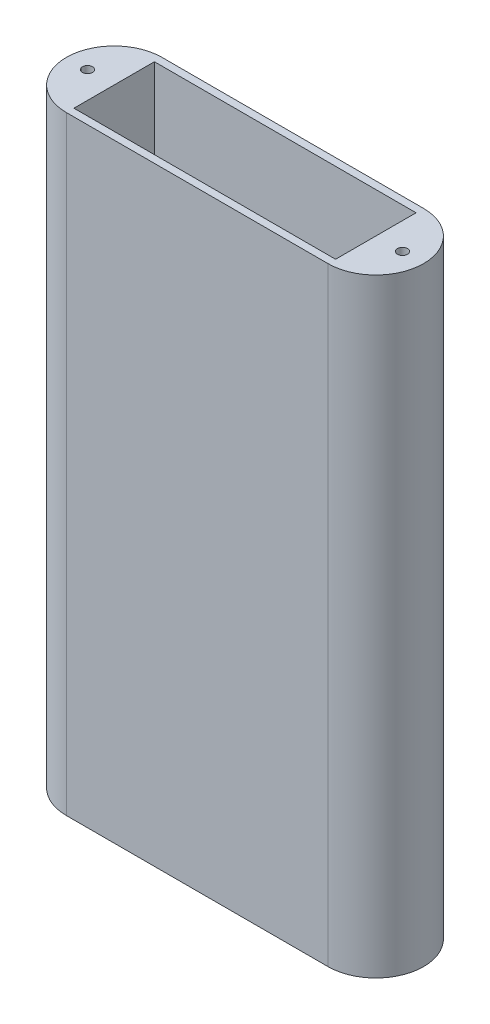
from build123d import *

# Parameters (mm, degrees)
BOSS_EXTRUDE1_DEPTH = 60.5
SHELL1_T            = -1.5
BOSS_EXTRUDE2_DEPTH = 60.5


with BuildPart() as part:
    # Sketch1 → Boss-Extrude1 (new, symmetric)
    with BuildSketch(Plane(origin=(0, 0, 0), x_dir=(1, 0, 0), z_dir=(0, 1, 0))):
        with BuildLine():
            Line((-26, 9.5), (26, 9.5))
            ThreePointArc((26, 9.5), (35.5, 0), (26, -9.5))
            Line((26, -9.5), (-26, -9.5))
            ThreePointArc((-26, -9.5), (-35.5, 0), (-26, 9.5))
        make_face()
    extrude(amount=BOSS_EXTRUDE1_DEPTH, both=True)

    # Shell1
    shell1_openings = [part.faces().sort_by_distance(p)[0] for p in [
        (0, 60.5, 0),
        (0, -60.5, 0),
    ]]
    offset(amount=SHELL1_T, openings=shell1_openings, kind=Kind.INTERSECTION)

    # Sketch2 → Boss-Extrude2 (add, symmetric)
    with BuildSketch(Plane(origin=(0, 0, 0), x_dir=(1, 0, 0), z_dir=(0, 1, 0))):
        with BuildLine():
            ThreePointArc((-34, 0), (-31.656854249, -5.656854249), (-26, -8))
            Line((-26, -8), (-26, 0))
            Line((-26, 0), (-30.3, 0))
            ThreePointArc((-30.3, 0), (-31.3, -1), (-32.3, 0))
            Line((-32.3, 0), (-34, 0))
        make_face()
        with BuildLine():
            Line((-30.3, 0), (-26, 0))
            Line((-26, 0), (-26, 8))
            ThreePointArc((-26, 8), (-31.656854249, 5.656854249), (-34, 0))
            Line((-34, 0), (-32.3, 0))
            ThreePointArc((-32.3, 0), (-31.3, 1), (-30.3, 0))
        make_face()
    boss_extrude2 = extrude(amount=BOSS_EXTRUDE2_DEPTH, both=True)

    # Mirror1: Boss-Extrude2 across plane
    add(boss_extrude2.mirror(Plane(origin=(0, 0, 0), x_dir=(0, 0, 1), z_dir=(1, 0, 0))))


solid = part.part
